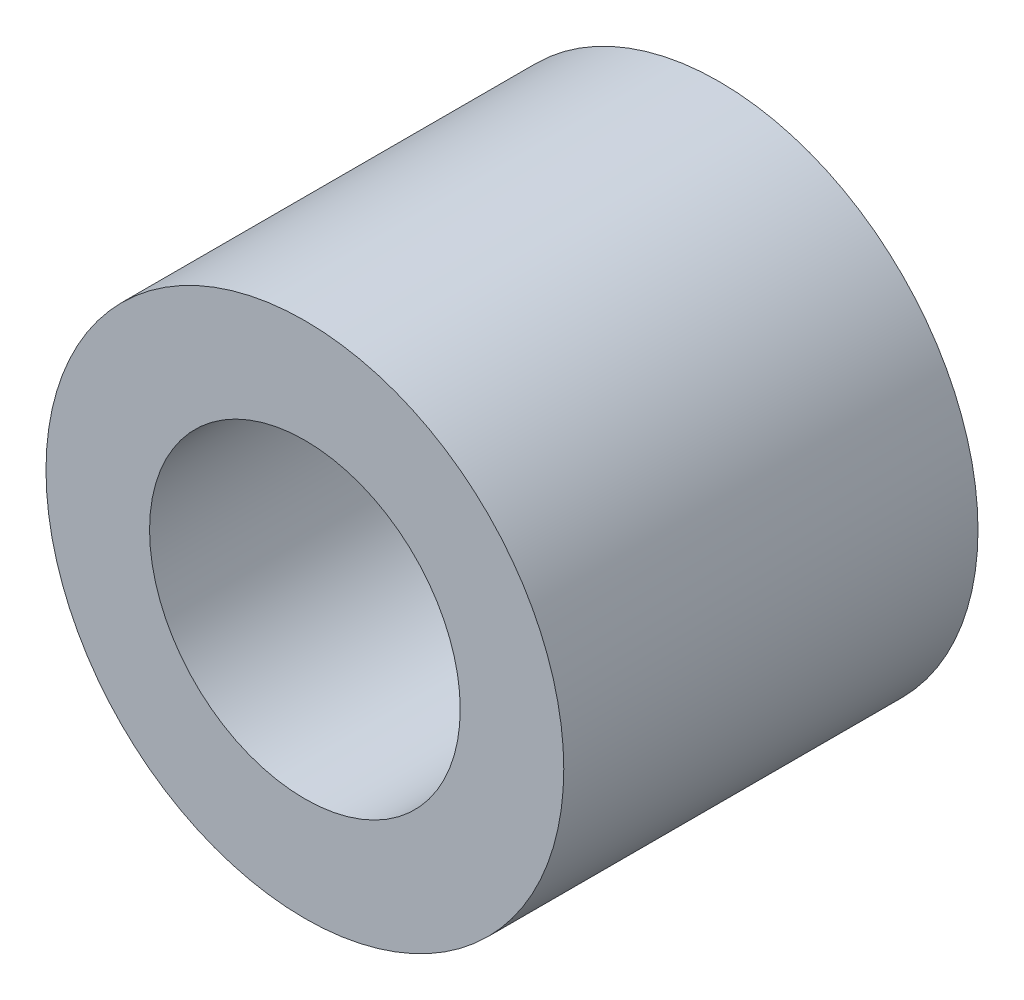
from build123d import *

# Parameters (mm, degrees)
SKETCH1_R           = 3.175
SKETCH1_R_2         = 1.905
BOSS_EXTRUDE1_DEPTH = 5.08


with BuildPart() as part:
    # Sketch1 → Boss-Extrude1 (new body)
    with BuildSketch(Plane.XY):
        Circle(SKETCH1_R)
        Circle(SKETCH1_R_2, mode=Mode.SUBTRACT)
    extrude(amount=BOSS_EXTRUDE1_DEPTH)


solid = part.part
